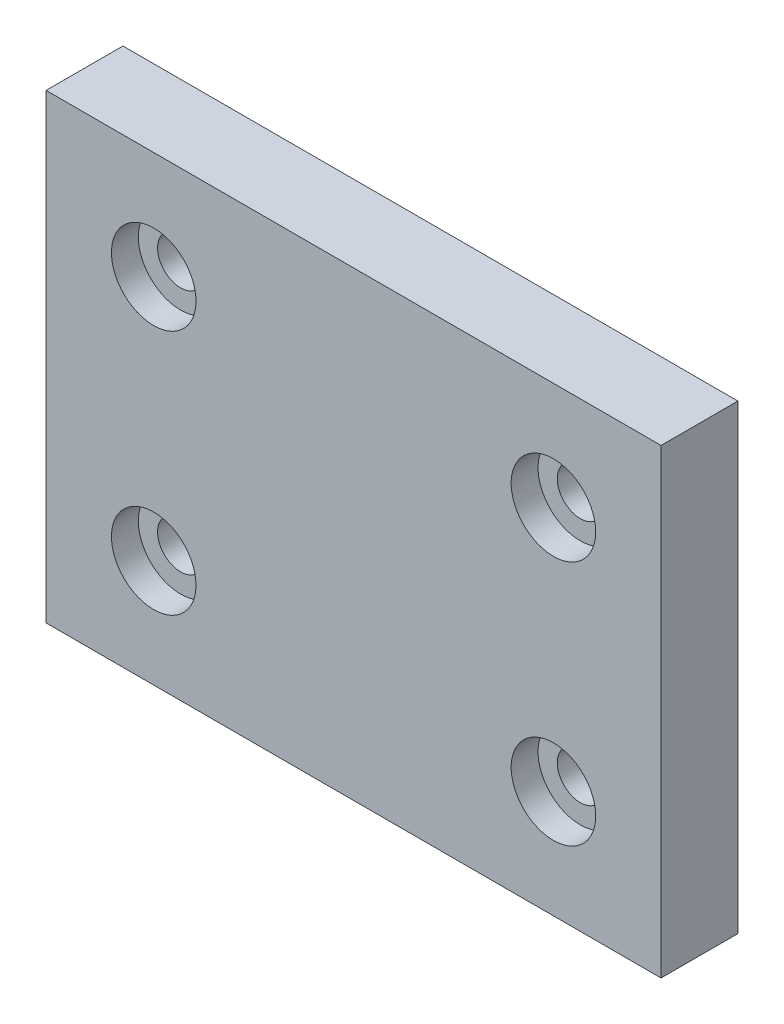
from build123d import *

# Parameters (mm, degrees)
SKETCH_1_W          = 80
SKETCH_1_H          = 60
EXTRUDE_1_DEPTH     = 10
SKETCH_2_R          = 5.5
CUT_EXTRUDE_1_DEPTH = 3.5
SKETCH_3_R          = 3
CUT_EXTRUDE_2_DEPTH = 51.990195136


with BuildPart() as part:
    # 草图1 → 凸台-拉伸1 (new body)
    with BuildSketch(Plane.XY):
        Rectangle(SKETCH_1_W, SKETCH_1_H)
    extrude(amount=EXTRUDE_1_DEPTH)

    # 草图2 → 切除-拉伸1 (cut)
    with BuildSketch(Plane.XY.offset(10)):
        with Locations((26, 16)):
            Circle(SKETCH_2_R)
        with Locations((26, -16)):
            Circle(SKETCH_2_R)
        with Locations((-26, 16)):
            Circle(SKETCH_2_R)
        with Locations((-26, -16)):
            Circle(SKETCH_2_R)
    extrude(amount=-CUT_EXTRUDE_1_DEPTH, mode=Mode.SUBTRACT)

    # 草图3 → 切除-拉伸2 (cut, through all)
    with BuildSketch(Plane.XY.offset(10)):
        with Locations((26, 16)):
            Circle(SKETCH_3_R)
        with Locations((26, -16)):
            Circle(SKETCH_3_R)
        with Locations((-26, 16)):
            Circle(SKETCH_3_R)
        with Locations((-26, -16)):
            Circle(SKETCH_3_R)
    extrude(amount=-CUT_EXTRUDE_2_DEPTH, mode=Mode.SUBTRACT)


solid = part.part
